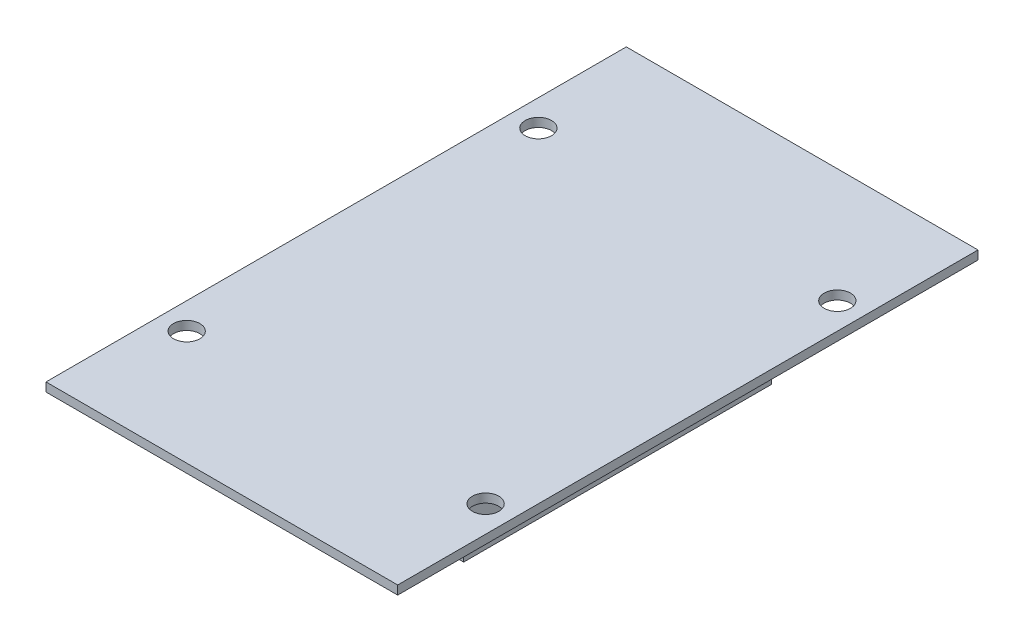
from build123d import *

# Parameters (mm, degrees)
SKETCH_1_W          = 40
SKETCH_1_H          = 1
EXTRUDE_1_DEPTH     = 66
SKETCH_2_W          = 24
SKETCH_2_H          = 35
EXTRUDE_2_DEPTH     = 8.5
SKETCH_3_R          = 1.5
CUT_EXTRUDE_1_DEPTH = 78.757636281


with BuildPart() as part:
    # ｽｹｯﾁ1 → ﾎﾞｽ - 押し出し1 (new body)
    with BuildSketch(Plane.XY):
        with Locations((20, 0.5)):
            Rectangle(SKETCH_1_W, SKETCH_1_H)
    extrude(amount=EXTRUDE_1_DEPTH)

    # ｽｹｯﾁ2 → ﾎﾞｽ - 押し出し2 (add)
    with BuildSketch(Plane.XZ):
        with Locations((20, 33)):
            Rectangle(SKETCH_2_W, SKETCH_2_H)
    extrude(amount=EXTRUDE_2_DEPTH)

    # ｽｹｯﾁ3 → ｶｯﾄ - 押し出し1 (cut, through all)
    with BuildSketch(Plane(origin=(0, 1, 0), x_dir=(1, 0, 0), z_dir=(0, 1, 0))):
        with Locations(Location((3, -13, 0), (0, 0, 180))):
            Circle(SKETCH_3_R)
        with Locations(Location((37, -13, 0), (0, 0, 180))):
            Circle(SKETCH_3_R)
        with Locations(Location((3, -53, 0), (0, 0, 180))):
            Circle(SKETCH_3_R)
        with Locations(Location((37, -53, 0), (0, 0, 180))):
            Circle(SKETCH_3_R)
    extrude(amount=-CUT_EXTRUDE_1_DEPTH, mode=Mode.SUBTRACT)


solid = part.part
